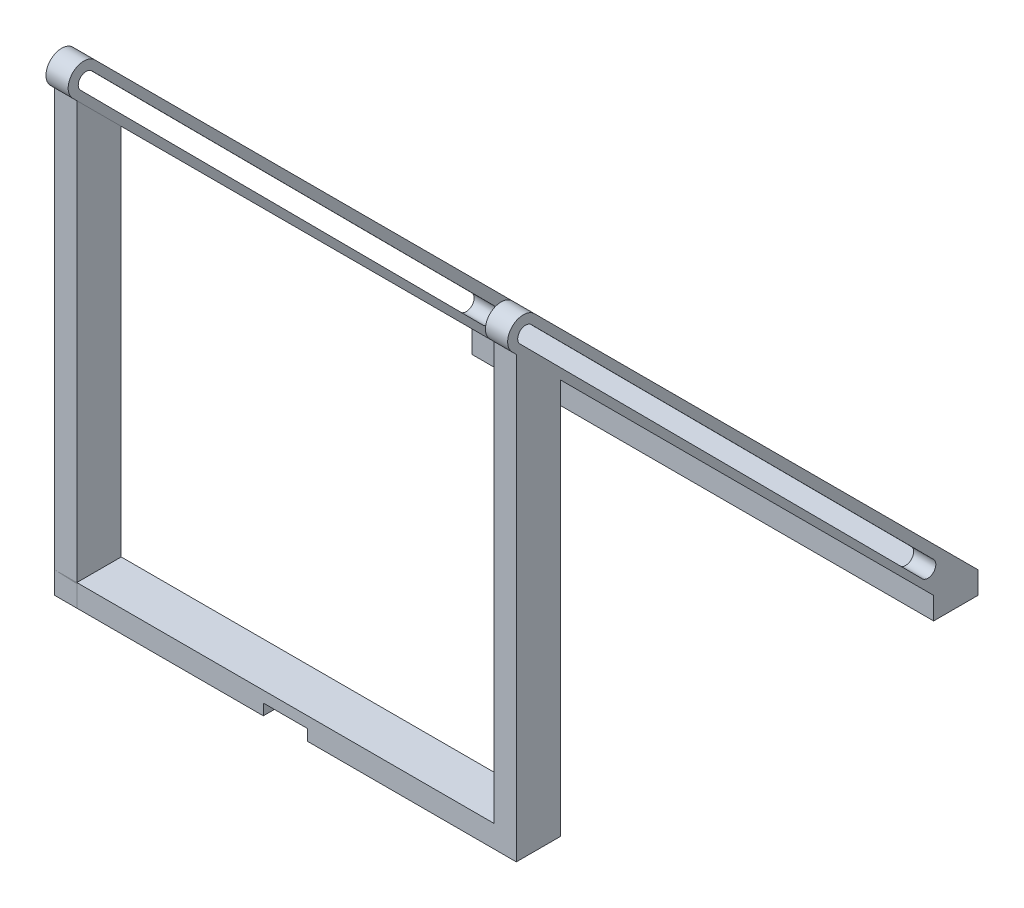
from build123d import *

# Parameters (mm, degrees)
SKETCH2_W                       = 925.068
SKETCH2_H                       = 88.9
BOSS_EXTRUDE1_DEPTH             = 44.45
BOSS_EXTRUDE1_2_DEPTH           = 44.45
SKETCH4_W                       = 44.45
SKETCH4_H                       = 88.9
FILLET1_R                       = 31.430896
CUT_EXTRUDE1_DEPTH              = 44.45
BOSS_EXTRUDE2_REACH             = 1120.361
SKETCH6_W                       = 44.45
SKETCH6_H                       = 88.9
BOSS_EXTRUDE2_DIRECTION_2_DEPTH = 44.45
FILLET1_OF_MIRROR8_R            = 31.430896
SKETCH1_W                       = 88.9
SKETCH1_H                       = 254
CUT_EXTRUDE2_DEPTH              = 22.225


with BuildPart() as part:
    # Sketch2 → Boss-Extrude1 (new body)
    with BuildSketch(Plane(origin=(0, 0, 0), x_dir=(1, 0, 0), z_dir=(0, 1, 0))):
        with Locations((0, 418.084)):
            Rectangle(SKETCH2_W, SKETCH2_H)
    extrude(amount=BOSS_EXTRUDE1_DEPTH)


with BuildPart() as body_2:
    # Sketch2 → Boss-Extrude1 2 (new body)
    with BuildSketch(Plane(origin=(0, 0, 0), x_dir=(1, 0, 0), z_dir=(0, 1, 0))):
        with Locations((0, -418.084)):
            Rectangle(SKETCH2_W, SKETCH2_H)
    extrude(amount=BOSS_EXTRUDE1_2_DEPTH)


with BuildPart() as body_3:
    # Sweep1: sweep along a path in Sketch3
    with BuildLine(Plane.ZY.offset(462.534)) as sweep1_path:
        Line((-462.534, 44.45), (435.491612107, 942.475612107))
    # Sketch4 → Sweep1 (sweep)
    with BuildSketch(Plane(origin=(0, 44.45, 0), x_dir=(1, 0, 0), z_dir=(0, 1, 0))):
        with Locations((-440.309, 418.084)):
            Rectangle(SKETCH4_W, SKETCH4_H)
    sweep1 = sweep(path=sweep1_path.line)

    # Fillet1
    fillet1_edges = [body_3.edges().sort_by_distance(p)[0] for p in [
        (-440.309, 942.475612107, 524.391612107),
        (-440.309, 942.475612107, 435.491612107),
    ]]
    fillet(fillet1_edges, radius=FILLET1_R)

    # Sketch5 → Cut-Extrude1 (cut)
    with BuildSketch(Plane.ZY.offset(462.534)):
        with BuildLine():
            Line((-373.382309225, 107.004633733), (432.613028854, 917.449274035))
            ThreePointArc((432.613028854, 917.449274035), (455.063584109, 917.5110699), (455.125379974, 895.060514644))
            Line((455.125379974, 895.060514644), (-350.869958105, 84.615874342))
            ThreePointArc((-350.869958105, 84.615874342), (-373.32051336, 84.554078477), (-373.382309225, 107.004633733))
        make_face()
    cut_extrude1 = extrude(amount=-CUT_EXTRUDE1_DEPTH, mode=Mode.SUBTRACT)


with BuildPart() as body_4:

    # Boss-Extrude2: up to this face of the body (flat: up to its plane)
    boss_extrude2_end = Plane(body_3.part.faces().sort_by_distance((-440.309, 466.634858203, 48.550858203))[0])
    # Sketch6 → Boss-Extrude2 (new, up to the picked face)
    with BuildSketch(Plane(origin=(0, 44.45, 0), x_dir=(1, 0, 0), z_dir=(0, 1, 0)), mode=Mode.PRIVATE) as boss_extrude2_sk1:
        with Locations((-440.309, -418.084)):
            Rectangle(SKETCH6_W, SKETCH6_H)
    boss_extrude2_tool1 = split(extrude(boss_extrude2_sk1.sketch, amount=BOSS_EXTRUDE2_REACH, mode=Mode.PRIVATE), bisect_by=boss_extrude2_end, keep=Keep.BOTH, mode=Mode.PRIVATE)
    boss_extrude2 = boss_extrude2_tool1.solids().sort_by(Axis((-440.309, 44.45, 418.084), (0, 1, 0)))[0]
    add(boss_extrude2)

    # Sketch6 → Boss-Extrude2 direction 2 (add)
    with BuildSketch(Plane(origin=(0, 44.45, 0), x_dir=(1, 0, 0), z_dir=(0, 1, 0))):
        with Locations((-440.309, -418.084)):
            Rectangle(SKETCH6_W, SKETCH6_H)
    boss_extrude2_direction_2 = extrude(amount=-BOSS_EXTRUDE2_DIRECTION_2_DEPTH)


with BuildPart() as body_2_1:
    add(body_2.part)

    # Mirror4: Boss-Extrude2, Boss-Extrude2 direction 2 across plane
    add(boss_extrude2.mirror(Plane(origin=(0, 0, 0), x_dir=(0, 0, 1), z_dir=(1, 0, 0))))
    add(boss_extrude2_direction_2.mirror(Plane(origin=(0, 0, 0), x_dir=(0, 0, 1), z_dir=(1, 0, 0))))


with BuildPart() as part_1:
    add(part.part)

    add(body_2_1.part)  # Mirror8 merges body 2
    # Mirror8: Sweep1 across plane
    add(sweep1.mirror(Plane(origin=(0, 0, 0), x_dir=(0, 0, 1), z_dir=(1, 0, 0))))

    # Mirror8 2: Cut-Extrude1 across plane
    add(cut_extrude1.mirror(Plane(origin=(0, 0, 0), x_dir=(0, 0, 1), z_dir=(1, 0, 0))), mode=Mode.SUBTRACT)

    # Fillet1 of Mirror8
    fillet1_of_mirror8_edges = [part_1.edges().sort_by_distance(p)[0] for p in [
        (440.309, 942.475612107, 524.391612107),
        (440.309, 942.475612107, 435.491612107),
    ]]
    fillet(fillet1_of_mirror8_edges, radius=FILLET1_OF_MIRROR8_R)

    # Sketch1 → Cut-Extrude2 (cut)
    with BuildSketch(Plane(origin=(0, 0, 0), x_dir=(1, 0, 0), z_dir=(0, 1, 0))):
        with Locations((0, -462.534)):
            Rectangle(SKETCH1_W, SKETCH1_H)
    extrude(amount=CUT_EXTRUDE2_DEPTH, mode=Mode.SUBTRACT)


solid = Compound([body_3.part, body_4.part, part_1.part])
